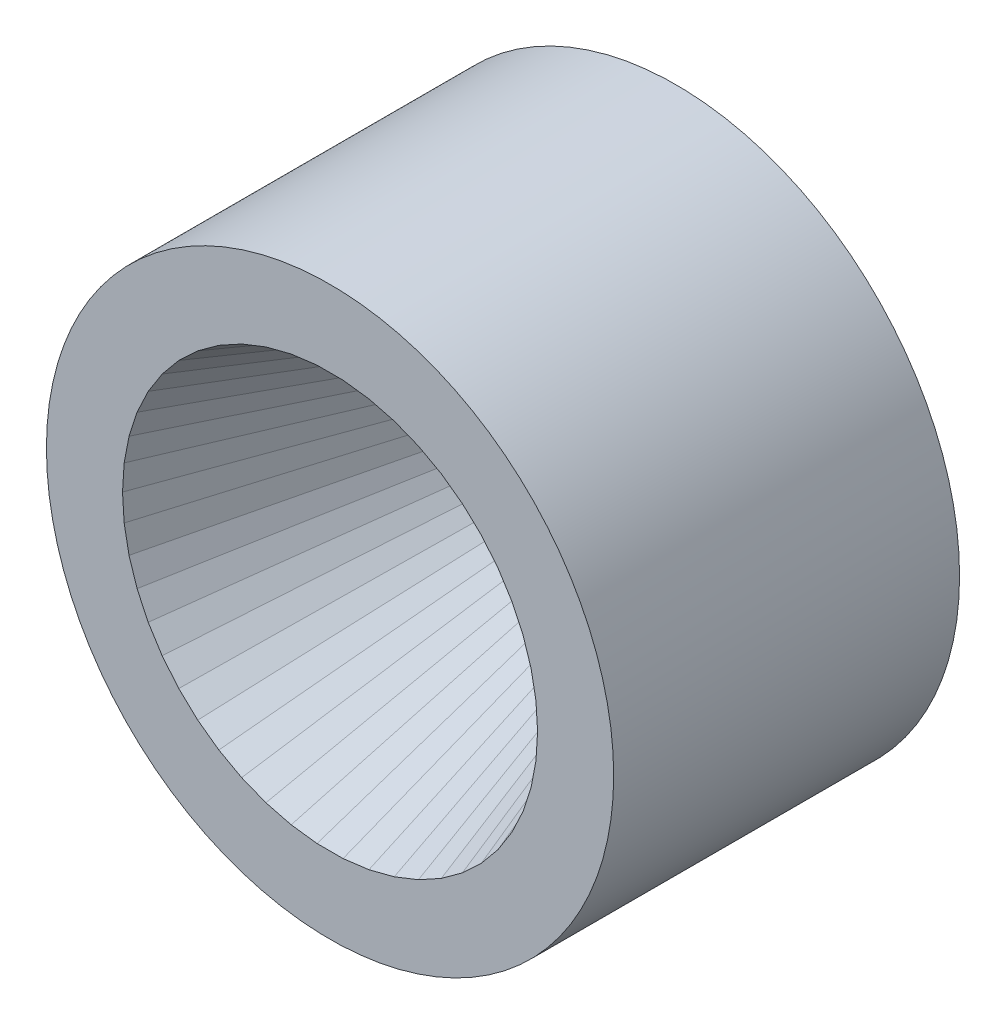
from build123d import *

# Parameters (mm, degrees)
ESQUISSE1_R             = 4.1
BOSS_EXTRU_1_DEPTH      = 5
ENL_V_MAT_EXTRU_1_DEPTH = 13.628539086
D_POUILLE1_ANGLE        = 19.963654133


with BuildPart() as part:
    # Esquisse1 → Boss.-Extru.1 (new body)
    with BuildSketch(Plane(origin=(0, 0, 0), x_dir=(-1, 0, 0), z_dir=(0, 0, -1))):
        with Locations((-4.099999911, 4.100000055)):
            Circle(ESQUISSE1_R)
    extrude(amount=-BOSS_EXTRU_1_DEPTH)

    # Esquisse2 → Enlèv. mat.-Extru.1 (cut, through all)
    with BuildSketch(Plane.XY.offset(5)):
        Polygon((7.076344, 4.476), (7.005749, 4.846069), (6.889329, 5.204373), (6.72892, 5.545261), (6.527051, 5.863356), (6.286906, 6.153641), (6.012272, 6.41154), (5.70748, 6.632984), (5.377338, 6.814481), (5.027051, 6.95317), (4.662144, 7.046862), (4.288372, 7.09408), (3.911628, 7.09408), (3.537856, 7.046862), (3.172949, 6.95317), (2.822662, 6.814481), (2.49252, 6.632984), (2.187728, 6.41154), (1.913094, 6.153641), (1.672949, 5.863356), (1.47108, 5.545261), (1.31067, 5.204373), (1.194251, 4.846069), (1.123656, 4.476), (1.1, 4.1), (1.123656, 3.724), (1.194251, 3.35393), (1.31067, 2.995626), (1.47108, 2.654739), (1.672949, 2.336644), (1.913094, 2.046359), (2.187728, 1.78846), (2.49252, 1.567016), (2.822662, 1.385519), (3.172949, 1.24683), (3.537856, 1.153138), (3.911628, 1.10592), (4.288372, 1.10592), (4.662144, 1.153138), (5.027051, 1.24683), (5.377338, 1.385519), (5.70748, 1.567016), (6.012272, 1.78846), (6.286906, 2.046359), (6.527051, 2.336644), (6.72892, 2.654739), (6.889329, 2.995626), (7.005749, 3.35393), (7.076344, 3.724), (7.1, 4.1), align=None)
    extrude(amount=-ENL_V_MAT_EXTRU_1_DEPTH, mode=Mode.SUBTRACT)

    # Dépouille1
    d_pouille1_faces = [part.faces().sort_by_distance(p)[0] for p in [
        (7.0410465, 4.6610345, 2.5),
        (6.947539, 5.025221, 2.5),
        (6.8091245, 5.374817, 2.5),
        (6.6279855, 5.7043085, 2.5),
        (6.4069785, 6.0084985, 2.5),
        (6.149589, 6.2825905, 2.5),
        (5.859876, 6.522262, 2.5),
        (5.542409, 6.7237325, 2.5),
        (5.2021945, 6.8838255, 2.5),
        (4.8445975, 7.000016, 2.5),
        (4.475258, 7.070471, 2.5),
        (4.1, 7.09408, 2.5),
        (3.724742, 7.070471, 2.5),
        (3.3554025, 7.000016, 2.5),
        (2.9978055, 6.8838255, 2.5),
        (2.657591, 6.7237325, 2.5),
        (2.340124, 6.522262, 2.5),
        (2.050411, 6.2825905, 2.5),
        (1.7930215, 6.0084985, 2.5),
        (1.5720145, 5.7043085, 2.5),
        (1.390875, 5.374817, 2.5),
        (1.2524605, 5.025221, 2.5),
        (1.1589535, 4.6610345, 2.5),
        (1.111828, 4.288, 2.5),
        (1.111828, 3.912, 2.5),
        (1.1589535, 3.538965, 2.5),
        (1.2524605, 3.174778, 2.5),
        (1.390875, 2.8251825, 2.5),
        (1.5720145, 2.4956915, 2.5),
        (1.7930215, 2.1915015, 2.5),
        (2.050411, 1.9174095, 2.5),
        (2.340124, 1.677738, 2.5),
        (2.657591, 1.4762675, 2.5),
        (2.9978055, 1.3161745, 2.5),
        (3.3554025, 1.199984, 2.5),
        (3.724742, 1.129529, 2.5),
        (4.1, 1.10592, 2.5),
        (4.475258, 1.129529, 2.5),
        (4.8445975, 1.199984, 2.5),
        (5.2021945, 1.3161745, 2.5),
        (5.542409, 1.4762675, 2.5),
        (5.859876, 1.677738, 2.5),
        (6.149589, 1.9174095, 2.5),
        (6.4069785, 2.1915015, 2.5),
        (6.6279855, 2.4956915, 2.5),
        (6.8091245, 2.8251825, 2.5),
        (6.947539, 3.174778, 2.5),
        (7.0410465, 3.538965, 2.5),
        (7.088172, 3.912, 2.5),
        (7.088172, 4.288, 2.5),
    ]]
    draft(d_pouille1_faces, Plane(origin=(4.099999911, 4.100000055, 5), x_dir=(1, 0, 0), z_dir=(0, 0, 1)), D_POUILLE1_ANGLE)


solid = part.part
